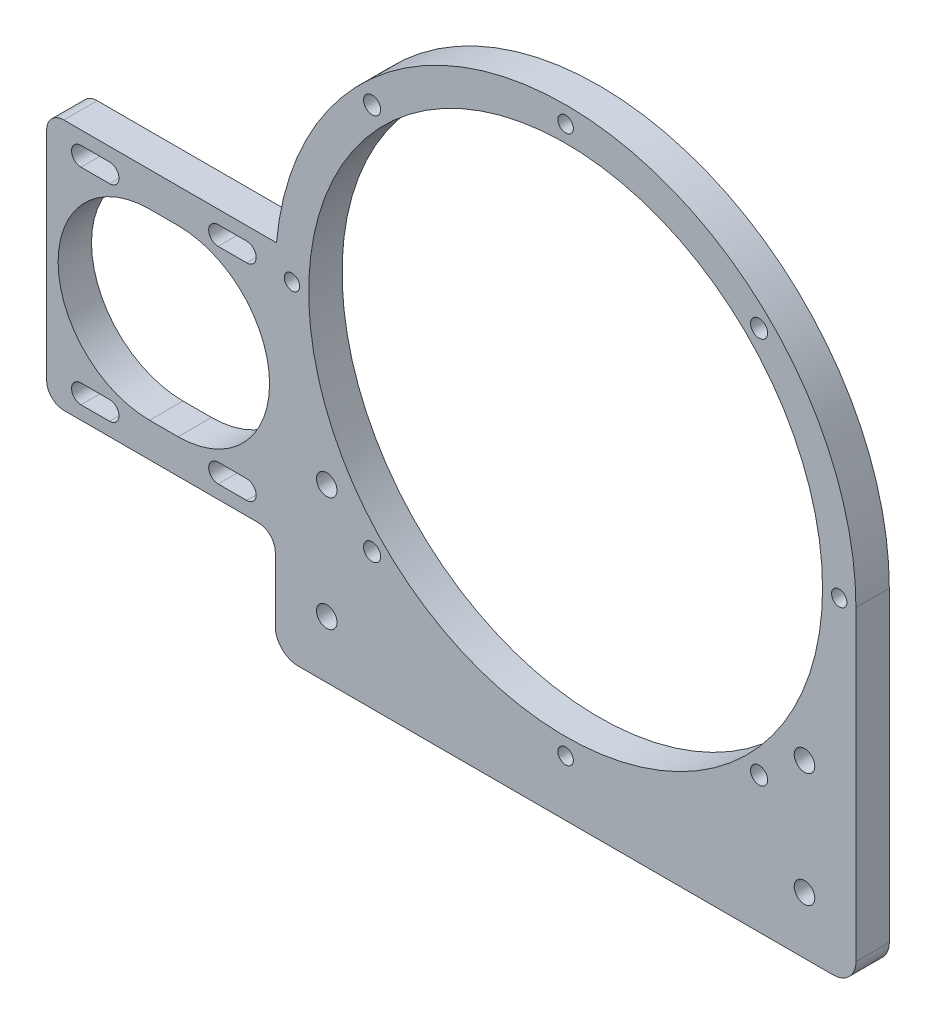
from build123d import *

# Parameters (mm, degrees)
SKETCH1_R           = 1.8
SKETCH1_R_2         = 1.5
SKETCH1_R_3         = 1.35
SKETCH1_R_4         = 44.958
BOSS_EXTRUDE1_DEPTH = 5.842
FILLET1_R           = 4
BOSS_EXTRUDE2_DEPTH = 5.842
FILLET2_R           = 3


with BuildPart() as part:
    # Sketch1 → Boss-Extrude1 (new body)
    # profile 1 of 2: a face of its own
    with BuildSketch(Plane.XY):
        with BuildLine():
            ThreePointArc((50.8, 0), (0, 50.8), (-50.8, 0))
            Line((-50.8, 0), (-50.8, -57.658))
            Line((-50.8, -57.658), (0, -57.658))
            Line((0, -57.658), (50.8, -57.658))
            Line((50.8, -57.658), (50.8, 0))
        make_face()
        with Locations((-41.8, -47.658)):
            Circle(SKETCH1_R, mode=Mode.SUBTRACT)
        with Locations((-33.855565576, -33.855565576)):
            Circle(SKETCH1_R_2, mode=Mode.SUBTRACT)
        with Locations((-41.8, -27.658)):
            Circle(SKETCH1_R, mode=Mode.SUBTRACT)
        with Locations((0, -47.879)):
            Circle(SKETCH1_R_3, mode=Mode.SUBTRACT)
        with Locations((41.8, -47.658)):
            Circle(SKETCH1_R, mode=Mode.SUBTRACT)
        with Locations((33.855565576, -33.855565576)):
            Circle(SKETCH1_R_2, mode=Mode.SUBTRACT)
        with Locations((41.8, -27.658)):
            Circle(SKETCH1_R, mode=Mode.SUBTRACT)
        with Locations((-47.879, 0)):
            Circle(SKETCH1_R_3, mode=Mode.SUBTRACT)
        Circle(SKETCH1_R_4, mode=Mode.SUBTRACT)
        with Locations((-33.855565576, 33.855565576)):
            Circle(SKETCH1_R_2, mode=Mode.SUBTRACT)
        with Locations((0, 47.879)):
            Circle(SKETCH1_R_3, mode=Mode.SUBTRACT)
        with Locations((47.879, 0)):
            Circle(SKETCH1_R_3, mode=Mode.SUBTRACT)
        with Locations((33.855565576, 33.855565576)):
            Circle(SKETCH1_R_2, mode=Mode.SUBTRACT)
    # profile 2 of 2: a face of its own
    with BuildSketch(Plane.XY):
        with BuildLine():
            ThreePointArc((50.8, 0), (0, 50.8), (-50.8, 0))
            Line((-50.8, 0), (-50.8, -57.658))
            Line((-50.8, -57.658), (0, -57.658))
            Line((0, -57.658), (50.8, -57.658))
            Line((50.8, -57.658), (50.8, 0))
        make_face()
        with Locations((-41.8, -47.658)):
            Circle(SKETCH1_R, mode=Mode.SUBTRACT)
        with Locations((-33.855565576, -33.855565576)):
            Circle(SKETCH1_R_2, mode=Mode.SUBTRACT)
        with Locations((-41.8, -27.658)):
            Circle(SKETCH1_R, mode=Mode.SUBTRACT)
        with Locations((0, -47.879)):
            Circle(SKETCH1_R_3, mode=Mode.SUBTRACT)
        with Locations((41.8, -47.658)):
            Circle(SKETCH1_R, mode=Mode.SUBTRACT)
        with Locations((33.855565576, -33.855565576)):
            Circle(SKETCH1_R_2, mode=Mode.SUBTRACT)
        with Locations((41.8, -27.658)):
            Circle(SKETCH1_R, mode=Mode.SUBTRACT)
        with Locations((-47.879, 0)):
            Circle(SKETCH1_R_3, mode=Mode.SUBTRACT)
        Circle(SKETCH1_R_4, mode=Mode.SUBTRACT)
        with Locations((-33.855565576, 33.855565576)):
            Circle(SKETCH1_R_2, mode=Mode.SUBTRACT)
        with Locations((0, 47.879)):
            Circle(SKETCH1_R_3, mode=Mode.SUBTRACT)
        with Locations((47.879, 0)):
            Circle(SKETCH1_R_3, mode=Mode.SUBTRACT)
        with Locations((33.855565576, 33.855565576)):
            Circle(SKETCH1_R_2, mode=Mode.SUBTRACT)
    extrude(amount=BOSS_EXTRUDE1_DEPTH)

    # Fillet1
    fillet1_edges = [part.edges().sort_by_distance(p)[0] for p in [
        (50.8, -57.658, 2.921),
        (-50.8, -57.658, 2.921),
    ]]
    fillet(fillet1_edges, radius=FILLET1_R)

    # Sketch2 → Boss-Extrude2 (add, through all)
    with BuildSketch(Plane.XY.offset(5.842)):
        Polygon((-50.592347052, 4.588509541), (-90.8, 4.588509541), (-90.8, -39.411490459), (-50.8, -39.411490459), align=None)
        with BuildLine():
            Line((-67.8, -33.411490459), (-72.8, -33.411490459))
            ThreePointArc((-72.8, -33.411490459), (-88.8, -17.411490459), (-72.8, -1.411490459))
            Line((-72.8, -1.411490459), (-67.8, -1.411490459))
            ThreePointArc((-67.8, -1.411490459), (-51.8, -17.411490459), (-67.8, -33.411490459))
        make_face(mode=Mode.SUBTRACT)
        with BuildLine():
            Line((-79.8, -1.061490459), (-84.8, -1.061490459))
            ThreePointArc((-84.8, -1.061490459), (-86.45, 0.588509541), (-84.8, 2.238509541))
            Line((-84.8, 2.238509541), (-79.8, 2.238509541))
            ThreePointArc((-79.8, 2.238509541), (-78.15, 0.588509541), (-79.8, -1.061490459))
        make_face(mode=Mode.SUBTRACT)
        with BuildLine():
            Line((-55.8, -1.061490459), (-60.8, -1.061490459))
            ThreePointArc((-60.8, -1.061490459), (-62.45, 0.588509541), (-60.8, 2.238509541))
            Line((-60.8, 2.238509541), (-55.8, 2.238509541))
            ThreePointArc((-55.8, 2.238509541), (-54.15, 0.588509541), (-55.8, -1.061490459))
        make_face(mode=Mode.SUBTRACT)
        with BuildLine():
            Line((-79.8, -37.061490459), (-84.8, -37.061490459))
            ThreePointArc((-84.8, -37.061490459), (-86.45, -35.411490459), (-84.8, -33.761490459))
            Line((-84.8, -33.761490459), (-79.8, -33.761490459))
            ThreePointArc((-79.8, -33.761490459), (-78.15, -35.411490459), (-79.8, -37.061490459))
        make_face(mode=Mode.SUBTRACT)
        with BuildLine():
            Line((-55.8, -37.061490459), (-60.8, -37.061490459))
            ThreePointArc((-60.8, -37.061490459), (-62.45, -35.411490459), (-60.8, -33.761490459))
            Line((-60.8, -33.761490459), (-55.8, -33.761490459))
            ThreePointArc((-55.8, -33.761490459), (-54.15, -35.411490459), (-55.8, -37.061490459))
        make_face(mode=Mode.SUBTRACT)
    extrude(amount=-BOSS_EXTRUDE2_DEPTH)

    # Fillet2
    fillet2_edges = [part.edges().sort_by_distance(p)[0] for p in [
        (-50.8, -39.411490459, 2.921),
        (-90.8, -39.411490459, 2.921),
        (-90.8, 4.588509541, 2.921),
    ]]
    fillet(fillet2_edges, radius=FILLET2_R)


solid = part.part
